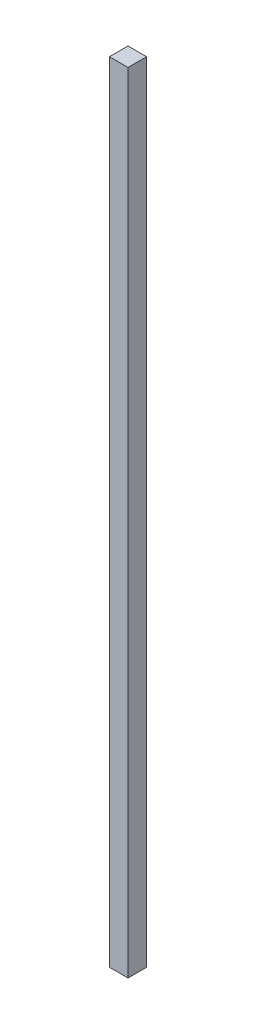
from build123d import *

# Parameters (mm, degrees)
PACK_KAPAK_KOLU_DIKEY_2_1_START = -596
SKETCH1_W                       = 8
SKETCH1_H                       = 340
PACK_KAPAK_KOLU_DIKEY_2_1_DEPTH = 8


with BuildPart() as part:
    # Sketch1 → PACK_kapak_kolu_dikey_2_1 (new body)
    with BuildSketch(Plane.XY.offset(PACK_KAPAK_KOLU_DIKEY_2_1_START)):
        with Locations((570, 810)):
            Rectangle(SKETCH1_W, SKETCH1_H)
    extrude(amount=-PACK_KAPAK_KOLU_DIKEY_2_1_DEPTH)


solid = part.part
